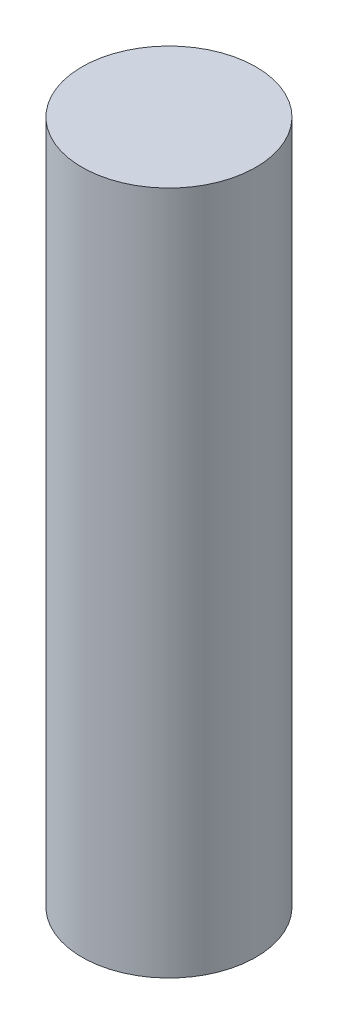
from build123d import *

# Parameters (mm, degrees)
SKETCH1_R           = 14.5
BOSS_EXTRUDE1_DEPTH = 114
SKETCH2_R           = 12.5
CUT_EXTRUDE2_DEPTH  = 105


with BuildPart() as part:
    # Sketch1 → Boss-Extrude1 (new body)
    with BuildSketch(Plane(origin=(0, 0, 0), x_dir=(1, 0, 0), z_dir=(0, 1, 0))):
        with Locations(Location((0, 0, 0), (0, 0, 90))):
            Circle(SKETCH1_R)
    extrude(amount=BOSS_EXTRUDE1_DEPTH)

    # Sketch2 → Cut-Extrude2 (cut)
    with BuildSketch(Plane(origin=(0, 0, 0), x_dir=(1, 0, 0), z_dir=(0, 1, 0))):
        with Locations(Location((0, 0, 0), (0, 0, 270))):
            Circle(SKETCH2_R)
    extrude(amount=CUT_EXTRUDE2_DEPTH, mode=Mode.SUBTRACT)


solid = part.part
